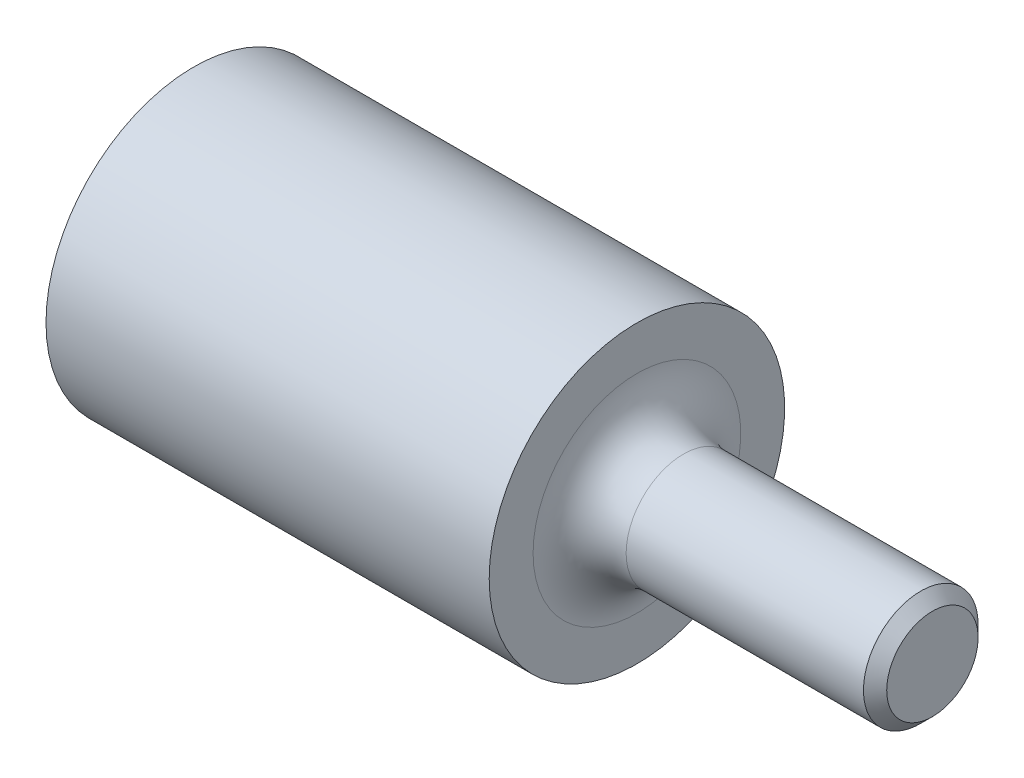
from build123d import *

# Parameters (mm, degrees)
CONG_1_R                = 2
ENL_V_MAT_EXTRU_1_DEPTH = 15.875
CHANFREIN1_SIZE         = 0.5


with BuildPart() as part:
    # Esquisse3 → Révolution1 (revolve)
    with BuildSketch(Plane(origin=(0, 0, 0), x_dir=(1, 0, 0), z_dir=(0, 1, 0)), mode=Mode.PRIVATE) as r_volution1_sk:
        Polygon((0, 6.35), (19.05, 6.35), (19.05, 2.4638), (31.75, 2.4638), (31.75, 0), (0, 0), align=None)
    revolve(r_volution1_sk.sketch.rotate(Axis((0, 0, 0), (1, 0, 0)), 180), axis=Axis((0, 0, 0), (1, 0, 0)))

    # Congé1
    cong_1_edges = [part.edges().sort_by_distance(p)[0] for p in [
        (19.05, 0, -2.4638),
    ]]
    fillet(cong_1_edges, radius=CONG_1_R)

    # Esquisse4 → Enlèv. mat.-Extru.1 (cut)
    with BuildSketch(Plane.ZY):
        with BuildLine():
            Line((2.794, -1.508041445), (2.794, 1.508041445))
            ThreePointArc((2.794, 1.508041445), (-3.175, 0), (2.794, -1.508041445))
        make_face()
    extrude(amount=-ENL_V_MAT_EXTRU_1_DEPTH, mode=Mode.SUBTRACT)

    # Chanfrein1
    chanfrein1_edges = [part.edges().sort_by_distance(p)[0] for p in [
        (31.75, 0, -2.4638),
    ]]
    chamfer(chanfrein1_edges, length=CHANFREIN1_SIZE)


solid = part.part
